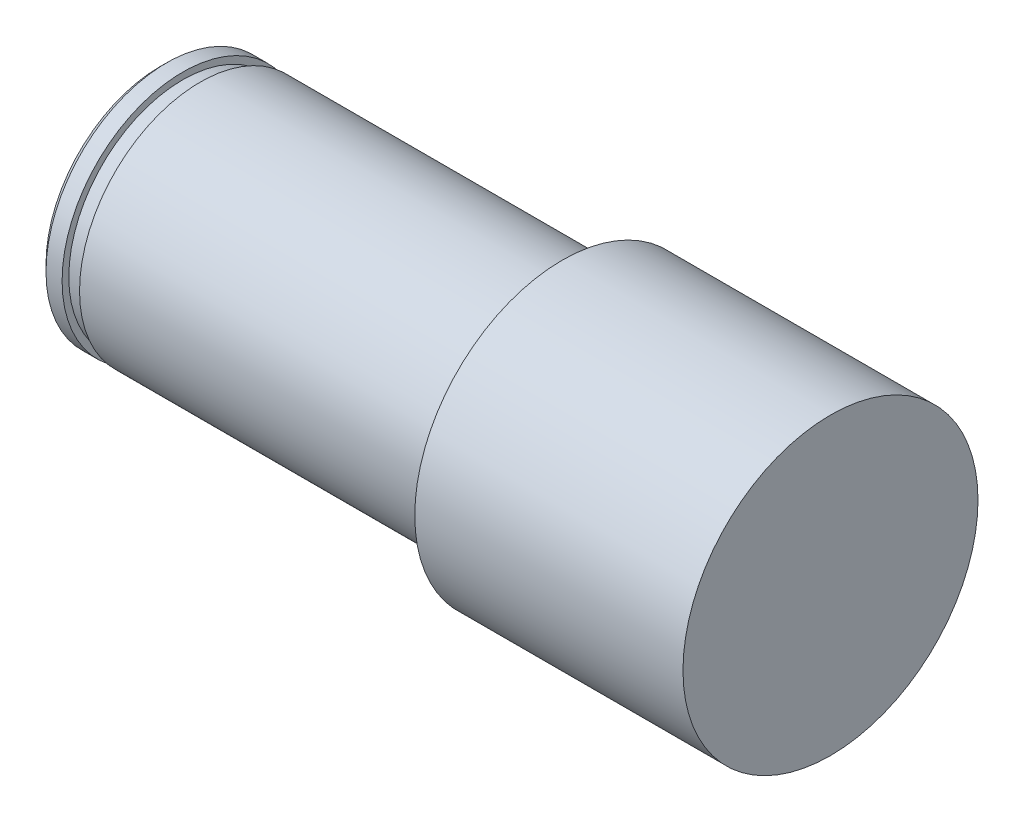
from build123d import *

# Parameters (mm, degrees)
CHANFRO1_SIZE = 0.5


with BuildPart() as part:
    # Esboço1 → Revolução1 (revolve)
    with BuildSketch(Plane(origin=(0, 0, 0), x_dir=(1, 0, 0), z_dir=(0, 1, 0)), mode=Mode.PRIVATE) as revolu_o1_sk:
        Polygon((0, 0), (0, 11), (-20, 11), (-20, 9), (-47, 9), (-47, 8.5), (-48.3, 8.5), (-48.3, 9), (-50, 9), (-50, 0), align=None)
    revolve(revolu_o1_sk.sketch.rotate(Axis((-50, 0, 0), (1, 0, 0)), 180), axis=Axis((-50, 0, 0), (1, 0, 0)))

    # Chanfro1
    chanfro1_edges = [part.edges().sort_by_distance(p)[0] for p in [
        (-50, 0, -9),
    ]]
    chamfer(chanfro1_edges, length=CHANFRO1_SIZE)


solid = part.part
